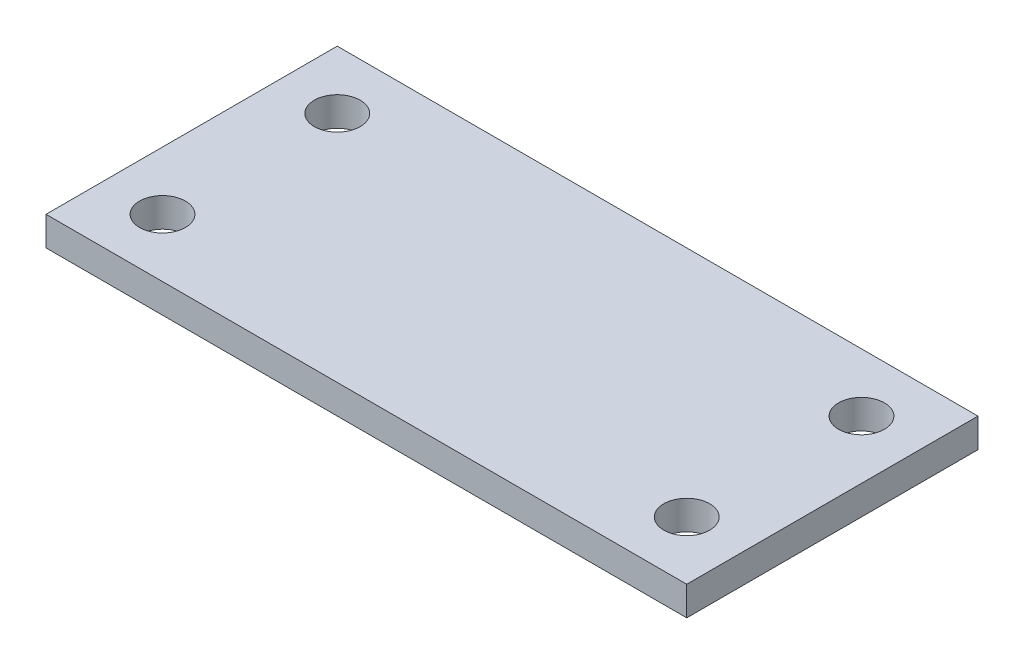
from build123d import *

# Parameters (mm, degrees)
SKETCH1_W           = 44
SKETCH1_H           = 20
SKETCH1_R           = 1.575
BOSS_EXTRUDE1_DEPTH = 2


with BuildPart() as part:
    # Sketch1 → Boss-Extrude1 (new body)
    with BuildSketch(Plane(origin=(0, 0, 0), x_dir=(1, 0, 0), z_dir=(0, 1, 0))):
        Rectangle(SKETCH1_W, SKETCH1_H)
        with Locations(Location((-18, 6, 0), (0, 0, 270))):
            Circle(SKETCH1_R, mode=Mode.SUBTRACT)
        with Locations(Location((18, 6, 0), (0, 0, 270))):
            Circle(SKETCH1_R, mode=Mode.SUBTRACT)
        with Locations(Location((18, -6, 0), (0, 0, 270))):
            Circle(SKETCH1_R, mode=Mode.SUBTRACT)
        with Locations(Location((-18, -6, 0), (0, 0, 270))):
            Circle(SKETCH1_R, mode=Mode.SUBTRACT)
    extrude(amount=BOSS_EXTRUDE1_DEPTH)


solid = part.part
